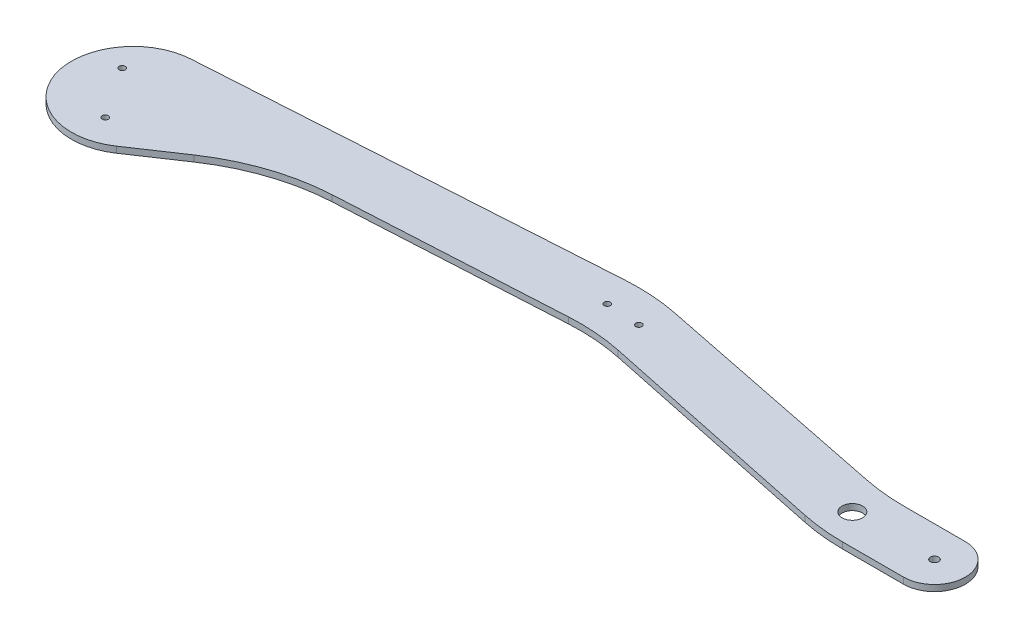
from build123d import *

# Parameters (mm, degrees)
BOSS_EXTRUDE1_DEPTH      = 1.5
BOSS_EXTRUDE1_DEPTH_BACK = 1.5
SKETCH1_R                = 5
SKETCH1_R_2              = 2
FILLET1_R                = 100
SKETCH2_R                = 1.5
CUT_EXTRUDE1_DEPTH       = 10


with BuildPart() as part:
    # Sketch1 → Boss-Extrude1 (new, two sides: drawn at the far end of the back side and taken through both)
    with BuildSketch(Plane(origin=(0, 0, 0), x_dir=(1, 0, 0), z_dir=(0, 1, 0)).offset(-BOSS_EXTRUDE1_DEPTH_BACK)):
        with BuildLine():
            Line((-138.053278996, 13.889014505), (-5.919683, -13.782501703))
            Line((-5.919683, -13.782501703), (0, -15))
            Line((0, -15), (40, -15))
            ThreePointArc((40, -15), (55, 0), (40, 15))
            Line((40, 15), (0, 15))
            Line((0, 15), (-139.784941349, 43.225909045))
            Line((-139.784941349, 43.225909045), (-351.875415017, 29.941322925))
            ThreePointArc((-351.875415017, 29.941322925), (-378.412739548, -9.628926804), (-333.285739517, -24.912516864))
            Line((-333.285739517, -24.912516864), (-287.823465989, 5.588948968))
            Line((-287.823465989, 5.588948968), (-138.053278996, 13.889014505))
        make_face()
        Circle(SKETCH1_R, mode=Mode.SUBTRACT)
        with Locations((40, 0)):
            Circle(SKETCH1_R_2, mode=Mode.SUBTRACT)
    extrude(amount=BOSS_EXTRUDE1_DEPTH + BOSS_EXTRUDE1_DEPTH_BACK)

    # Fillet1
    fillet1_edges = [part.edges().sort_by_distance(p)[0] for p in [
        (0, 0, -15),
        (-139.784941349, 0, -43.225909045),
        (-138.053278996, 0, -13.889014505),
        (-287.823465989, 0, -5.588948968),
        (0, 0, 15),
    ]]
    fillet(fillet1_edges, radius=FILLET1_R)

    # Sketch2 → Cut-Extrude1 (cut)
    with BuildSketch(Plane(origin=(0, 1.5, 0), x_dir=(1, 0, 0), z_dir=(0, 1, 0))):
        with Locations((-147.336246923, 28.050603479)):
            Circle(SKETCH2_R)
        with Locations((-130.791911053, 26.905656844)):
            Circle(SKETCH2_R)
        with Locations((-364.746711272, 9.415773639)):
            Circle(SKETCH2_R)
        with Locations((-348.032450789, -15.496743225)):
            Circle(SKETCH2_R)
    extrude(amount=-CUT_EXTRUDE1_DEPTH, mode=Mode.SUBTRACT)


solid = part.part
